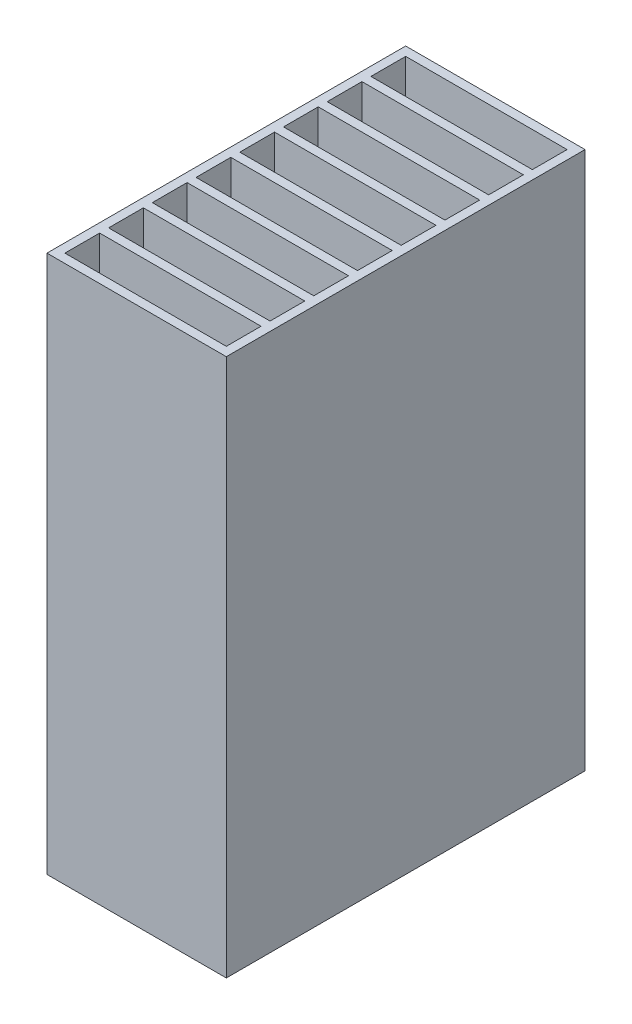
from build123d import *

# Parameters (mm, degrees)
ESQUISSE1_W             = 60
ESQUISSE1_H             = 40
BOSS_EXTRU_1_DEPTH      = 20
ESQUISSE2_W             = 18
ESQUISSE2_H             = 3.875
ENL_V_MAT_EXTRU_1_DEPTH = 67.332495807


with BuildPart() as part:
    # Esquisse1 → Boss.-Extru.1 (new body)
    with BuildSketch(Plane.YZ):
        Rectangle(ESQUISSE1_W, ESQUISSE1_H)
    extrude(amount=BOSS_EXTRU_1_DEPTH)

    # Esquisse2 → Enlèv. mat.-Extru.1 (cut, through all)
    with BuildSketch(Plane.XZ.offset(30)):
        with Locations((10, 17.0625)):
            Rectangle(ESQUISSE2_W, ESQUISSE2_H)
        with Locations((10, 12.1875)):
            Rectangle(ESQUISSE2_W, ESQUISSE2_H)
        with Locations((10, 7.3125)):
            Rectangle(ESQUISSE2_W, ESQUISSE2_H)
        with Locations((10, 2.4375)):
            Rectangle(ESQUISSE2_W, ESQUISSE2_H)
        with Locations((10, -2.4375)):
            Rectangle(ESQUISSE2_W, ESQUISSE2_H)
        with Locations((10, -7.3125)):
            Rectangle(ESQUISSE2_W, ESQUISSE2_H)
        with Locations((10, -12.1875)):
            Rectangle(ESQUISSE2_W, ESQUISSE2_H)
        with Locations((10, -17.0625)):
            Rectangle(ESQUISSE2_W, ESQUISSE2_H)
    extrude(amount=-ENL_V_MAT_EXTRU_1_DEPTH, mode=Mode.SUBTRACT)


solid = part.part
